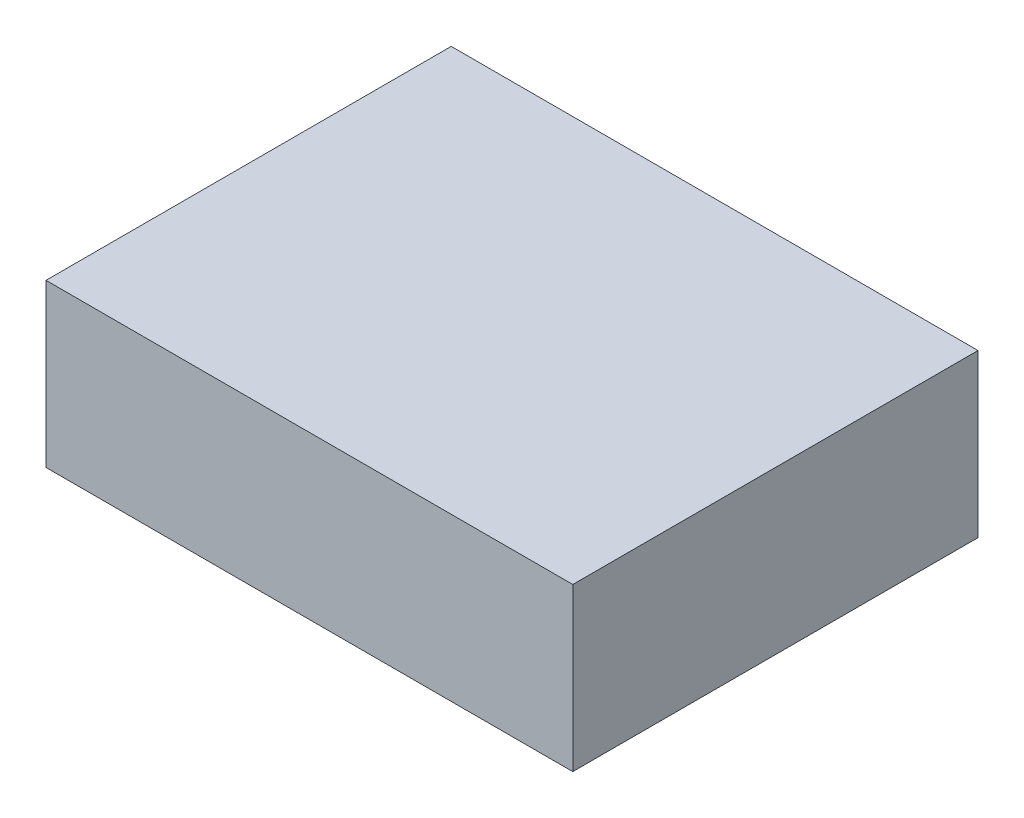
from build123d import *

# Parameters (mm, degrees)
SKETCH_1_W      = 65
SKETCH_1_H      = 50
EXTRUDE_1_DEPTH = 20


with BuildPart() as part:
    # 草图1 → 凸台-拉伸1 (new body)
    with BuildSketch(Plane(origin=(0, 0, 0), x_dir=(1, 0, 0), z_dir=(0, 1, 0))):
        Rectangle(SKETCH_1_W, SKETCH_1_H)
    extrude(amount=EXTRUDE_1_DEPTH)


solid = part.part
